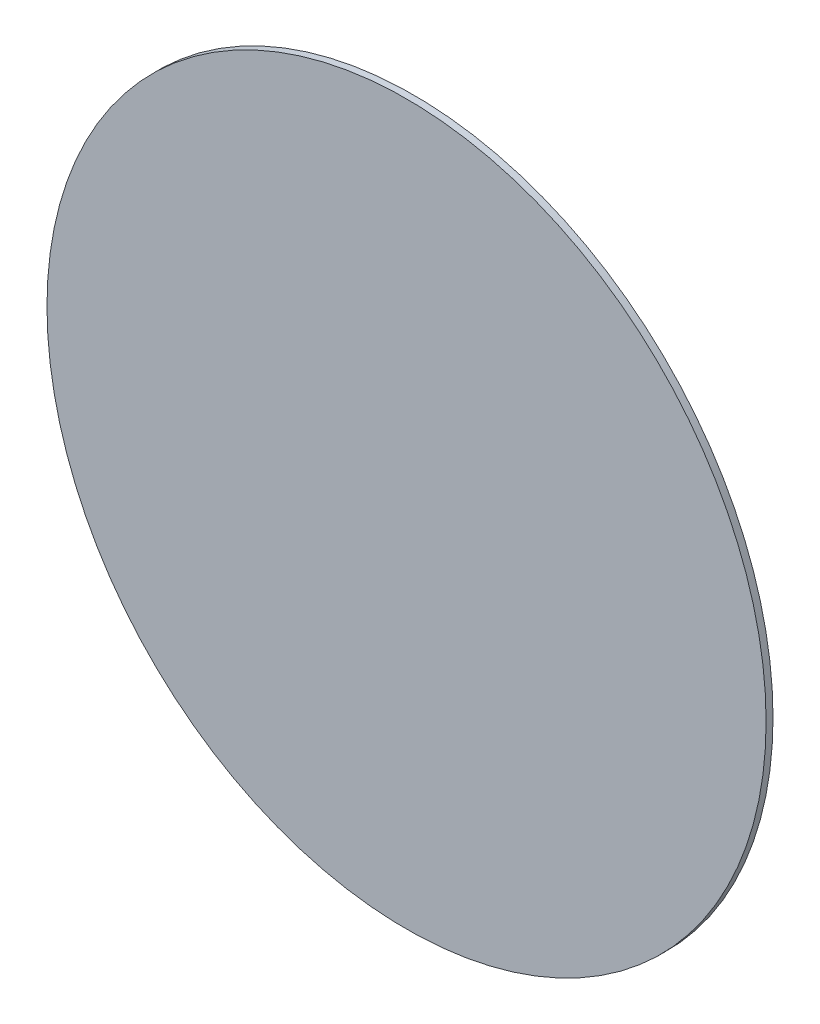
from build123d import *

# Parameters (mm, degrees)
SKETCH1_R           = 26
BOSS_EXTRUDE1_DEPTH = 0.5


with BuildPart() as part:
    # Sketch1 → Boss-Extrude1 (new body)
    with BuildSketch(Plane.XY):
        Circle(SKETCH1_R)
    extrude(amount=BOSS_EXTRUDE1_DEPTH)


solid = part.part
